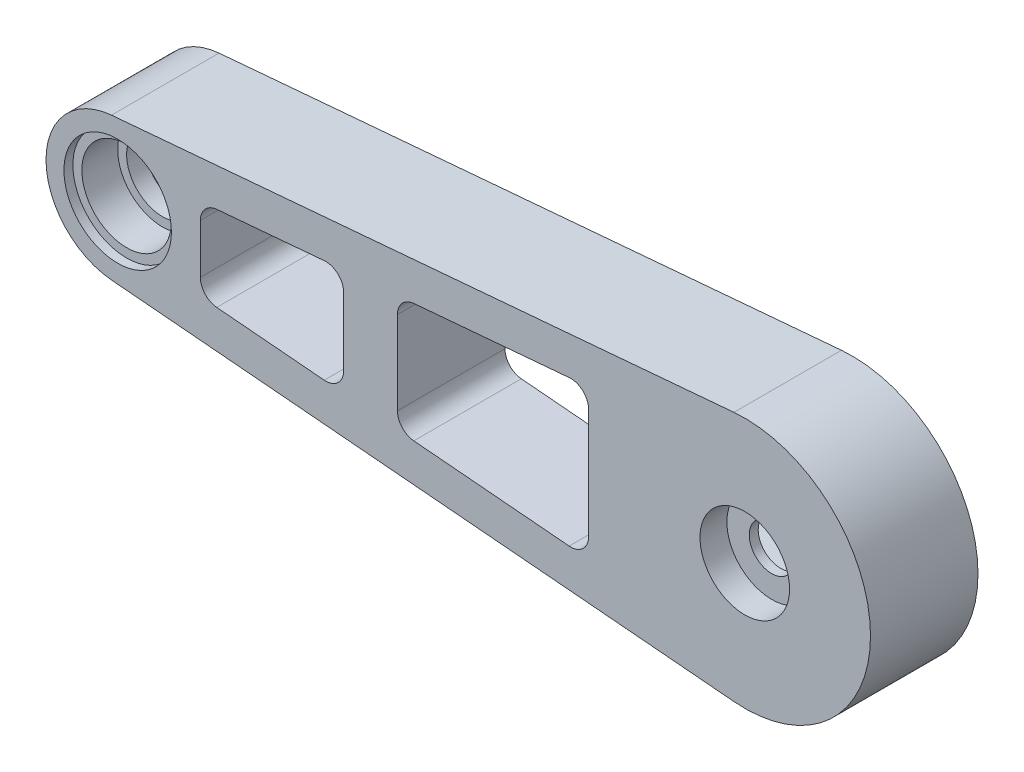
from build123d import *

# Parameters (mm, degrees)
EXTRUDE_1_DEPTH      = 6
CUT_EXTRUDE_1_DEPTH  = 41.077836542
FILLET_1_R           = 1
SKETCH_7_R           = 2
CUT_EXTRUDE_2_DEPTH  = 41.077836542
SKETCH_7_4_R         = 2.5
SKETCH_7_4_R_2       = 2
CUT_EXTRUDE_4_DEPTH  = 2.5
SKETCH_7_5_R         = 3
SKETCH_7_5_R_2       = 2.5
CUT_EXTRUDE_5_DEPTH  = 0.5
CUT_EXTRUDE_9_DEPTH  = 4
SKETCH_13_R          = 1.25
CUT_EXTRUDE_10_DEPTH = 40.827540495
SKETCH_14_R          = 2.5
CUT_EXTRUDE_11_DEPTH = 1.5
CUT_EXTRUDE_START    = -2.5
SKETCH_15_R          = 2.5
CUT_EXTRUDE_13_DEPTH = 2.5
CUT_EXTRUDE_START_2  = -0.5
SKETCH_15_4_R        = 3
SKETCH_15_4_R_2      = 2.5
CUT_EXTRUDE_14_DEPTH = 0.5


with BuildPart() as part:
    # 草图2 → 凸台-拉伸1 (new body)
    with BuildSketch(Plane.XY):
        with BuildLine():
            Line((-35.344756781, 3.98511515), (-0.604756988, 6.99051149))
            ThreePointArc((-0.604756988, 6.99051149), (7.01662183, 0), (-0.604756988, -6.99051149))
            Line((-0.604756988, -6.99051149), (-35.344756781, -3.98511515))
            ThreePointArc((-35.344756781, -3.98511515), (-39, 0), (-35.344756781, 3.98511515))
        make_face()
    extrude(amount=EXTRUDE_1_DEPTH)

    # 草图6 → 切除-拉伸1 (cut, through all)
    with BuildSketch(Plane.XY.offset(6)):
        Polygon((-30.385995652, 2.291125705), (-22.385995652, 2.983214677), (-22.385995652, -2.983214677), (-30.385995652, -2.291125705), align=None)
        Polygon((-19.385995652, 3.242748041), (-19.385995652, -3.242748041), (-8.71565209, -4.165851428), (-8.71565209, 4.165851428), align=None)
    extrude(amount=-CUT_EXTRUDE_1_DEPTH, mode=Mode.SUBTRACT)

    # 圆角1
    fillet_1_edges = [part.edges().sort_by_distance(p)[0] for p in [
        (-8.71565209, -4.165851428, 3),
        (-8.71565209, 4.165851428, 3),
        (-19.385995652, -3.242748041, 3),
        (-19.385995652, 3.242748041, 3),
        (-22.385995652, -2.983214677, 3),
        (-22.385995652, 2.983214677, 3),
        (-30.385995652, -2.291125705, 3),
        (-30.385995652, 2.291125705, 3),
    ]]
    fillet(fillet_1_edges, radius=FILLET_1_R)

    # 草图7 → 切除-拉伸2 (cut, through all)
    with BuildSketch(Plane.XY.offset(6)):
        with Locations((-35, 0)):
            Circle(SKETCH_7_R)
    extrude(amount=-CUT_EXTRUDE_2_DEPTH, mode=Mode.SUBTRACT)

    # 草图7<4> → 切除-拉伸4 (cut)
    with BuildSketch(Plane.XY.offset(6)):
        with Locations((-35, 0)):
            Circle(SKETCH_7_4_R)
        with Locations((-35, 0)):
            Circle(SKETCH_7_4_R_2, mode=Mode.SUBTRACT)
    extrude(amount=-CUT_EXTRUDE_4_DEPTH, mode=Mode.SUBTRACT)

    # 草图7<5> → 切除-拉伸5 (cut)
    with BuildSketch(Plane.XY.offset(6)):
        with Locations((-35, 0)):
            Circle(SKETCH_7_5_R)
        with Locations((-35, 0)):
            Circle(SKETCH_7_5_R_2, mode=Mode.SUBTRACT)
    extrude(amount=-CUT_EXTRUDE_5_DEPTH, mode=Mode.SUBTRACT)

    # 草图12 → 切除-拉伸9 (cut)
    with BuildSketch(Plane(origin=(0, 0, 0), x_dir=(-1, 0, 0), z_dir=(0, 0, -1))):
        with BuildLine():
            Line((12.25, 1.984313483), (0.4375, 3.472548596))
            ThreePointArc((0.4375, 3.472548596), (-3.5, 0), (0.4375, -3.472548596))
            Line((0.4375, -3.472548596), (12.25, -1.984313483))
            ThreePointArc((12.25, -1.984313483), (14, 0), (12.25, 1.984313483))
        make_face()
    extrude(amount=-CUT_EXTRUDE_9_DEPTH, mode=Mode.SUBTRACT)

    # 草图13 → 切除-拉伸10 (cut, through all)
    with BuildSketch(Plane(origin=(0, 0, 4), x_dir=(-1, 0, 0), z_dir=(0, 0, -1))):
        Circle(SKETCH_13_R)
    extrude(amount=-CUT_EXTRUDE_10_DEPTH, mode=Mode.SUBTRACT)

    # 草图14 → 切除-拉伸11 (cut)
    with BuildSketch(Plane.XY.offset(6)):
        Circle(SKETCH_14_R)
    extrude(amount=-CUT_EXTRUDE_11_DEPTH, mode=Mode.SUBTRACT)

    # 草图15 → 切除-拉伸13 (cut)
    with BuildSketch(Plane(origin=(0, 0, 0), x_dir=(-1, 0, 0), z_dir=(0, 0, -1)).offset(CUT_EXTRUDE_START)):
        with Locations((35, 0)):
            Circle(SKETCH_15_R)
    extrude(amount=CUT_EXTRUDE_13_DEPTH, mode=Mode.SUBTRACT)

    # 草图15<4> → 切除-拉伸14 (cut)
    with BuildSketch(Plane(origin=(0, 0, 0), x_dir=(-1, 0, 0), z_dir=(0, 0, -1)).offset(CUT_EXTRUDE_START_2)):
        with Locations((35, 0)):
            Circle(SKETCH_15_4_R)
        with Locations((35, 0)):
            Circle(SKETCH_15_4_R_2, mode=Mode.SUBTRACT)
    extrude(amount=CUT_EXTRUDE_14_DEPTH, mode=Mode.SUBTRACT)


solid = part.part
